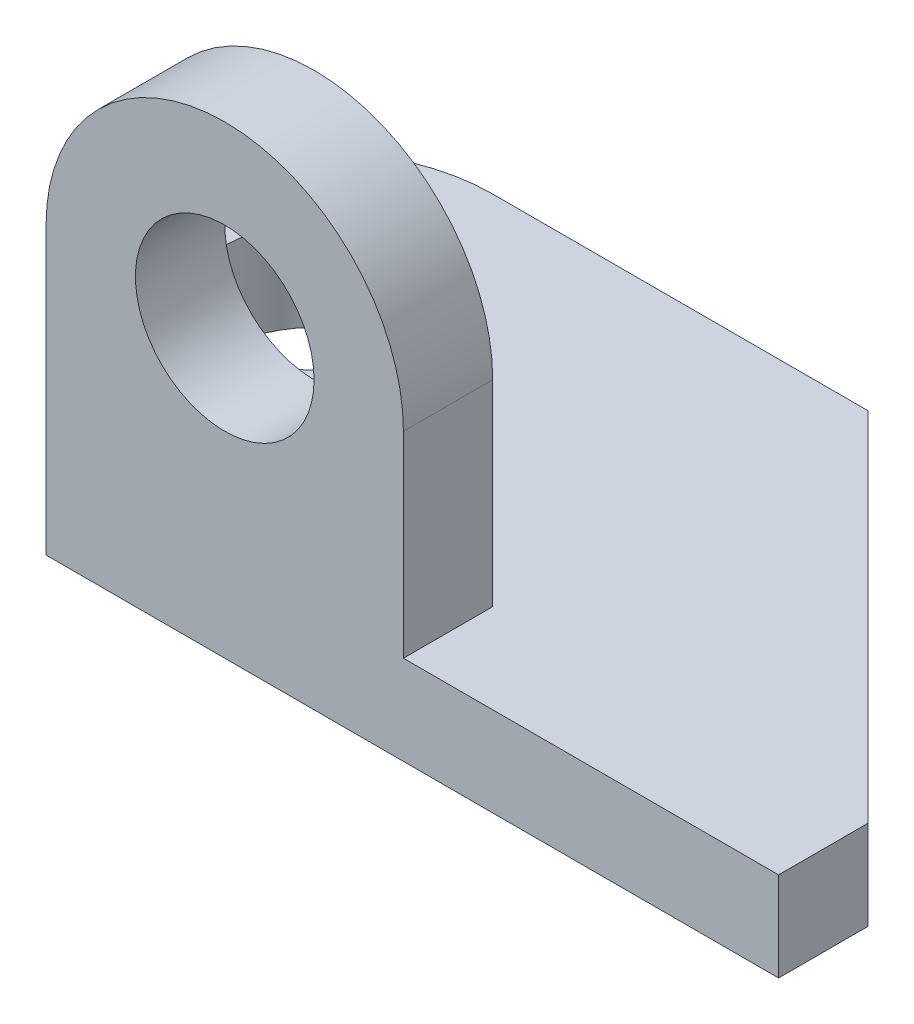
from build123d import *

# Parameters (mm, degrees)
SKETCH1_R           = 254
SKETCH1_W           = 1016
SKETCH1_H           = 254
BOSS_EXTRUDE1_DEPTH = 254
SKETCH3_R           = 254
BOSS_EXTRUDE3_DEPTH = 254


with BuildPart() as part:
    # Sketch1 → Boss-Extrude1 (new body)
    # profile 1 of 2: a face of its own
    with BuildSketch(Plane(origin=(0, 0, 0), x_dir=(1, 0, 0), z_dir=(0, 1, 0))):
        with BuildLine():
            Line((1066.8, 1270), (0, 1270))
            ThreePointArc((0, 1270), (-508, 762), (0, 254))
            Line((0, 254), (1016, 254))
            Line((1016, 254), (1016, 0))
            Line((1016, 0), (2082.8, 0))
            Line((2082.8, 0), (2082.8, 254))
            Line((2082.8, 254), (1066.8, 1270))
        make_face()
        with Locations(Location((0, 762, 0), (0, 0, 270))):
            Circle(SKETCH1_R, mode=Mode.SUBTRACT)
    # profile 2 of 2: a face of its own
    with BuildSketch(Plane(origin=(0, 0, 0), x_dir=(1, 0, 0), z_dir=(0, 1, 0))):
        with Locations((508, 127)):
            Rectangle(SKETCH1_W, SKETCH1_H)
    extrude(amount=BOSS_EXTRUDE1_DEPTH)

    # Sketch3 → Boss-Extrude3 (add)
    with BuildSketch(Plane.XY):
        with BuildLine():
            Line((0, 812.8), (0, 254))
            Line((0, 254), (1016, 254))
            Line((1016, 254), (1016, 812.8))
            ThreePointArc((1016, 812.8), (508, 1320.8), (0, 812.8))
        make_face()
        with Locations((508, 812.8)):
            Circle(SKETCH3_R, mode=Mode.SUBTRACT)
    extrude(amount=-BOSS_EXTRUDE3_DEPTH)


solid = part.part
